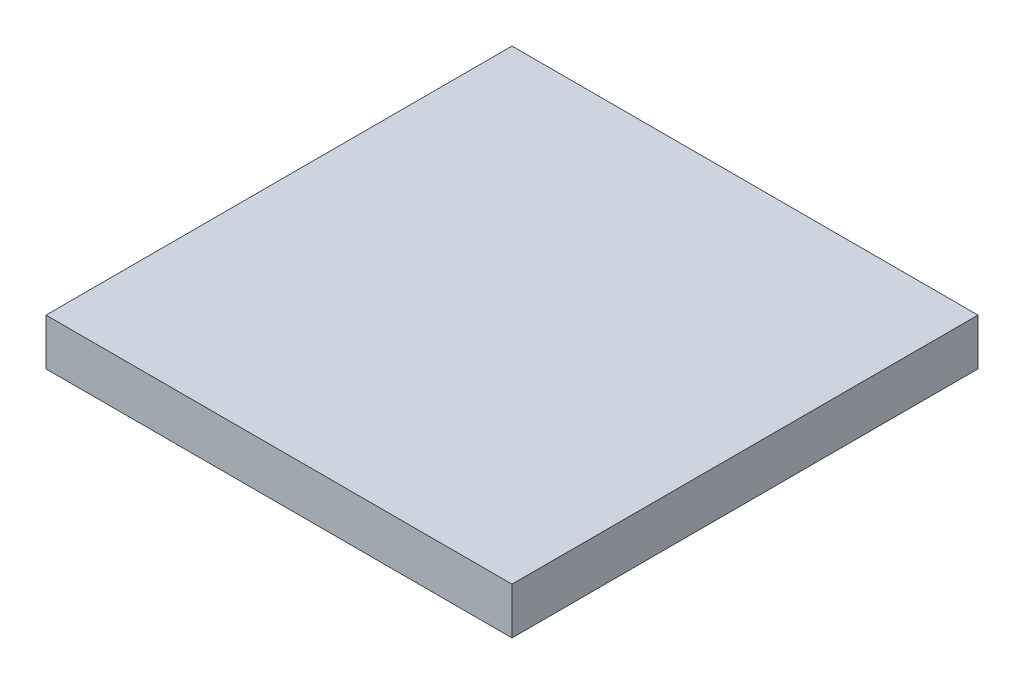
from build123d import *

# Parameters (mm, degrees)
SKETCH_1_W      = 100
SKETCH_1_H      = 100
EXTRUDE_1_DEPTH = 10


with BuildPart() as part:
    # 草图1 → 凸台-拉伸1 (new body)
    with BuildSketch(Plane(origin=(0, 0, 0), x_dir=(1, 0, 0), z_dir=(0, 1, 0))):
        with Locations((50, 50)):
            Rectangle(SKETCH_1_W, SKETCH_1_H)
    extrude(amount=EXTRUDE_1_DEPTH)


solid = part.part
